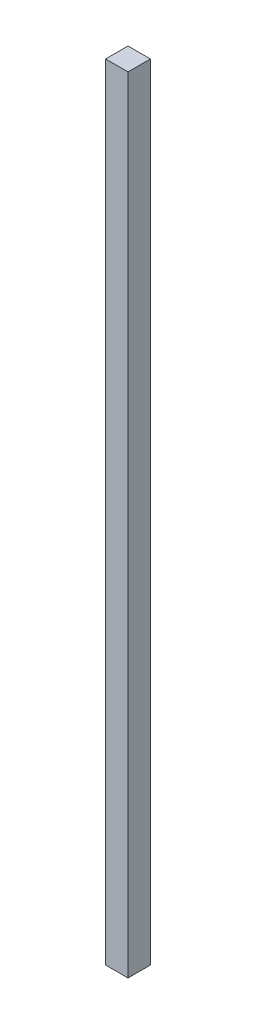
from build123d import *

# Parameters (mm, degrees)
SKETCH1_W           = 20
SKETCH1_H           = 20
BOSS_EXTRUDE1_DEPTH = 700


with BuildPart() as part:
    # Sketch1 → Boss-Extrude1 (new body)
    with BuildSketch(Plane(origin=(0, 0, 0), x_dir=(1, 0, 0), z_dir=(0, 1, 0))):
        Rectangle(SKETCH1_W, SKETCH1_H)
    extrude(amount=BOSS_EXTRUDE1_DEPTH)


solid = part.part
